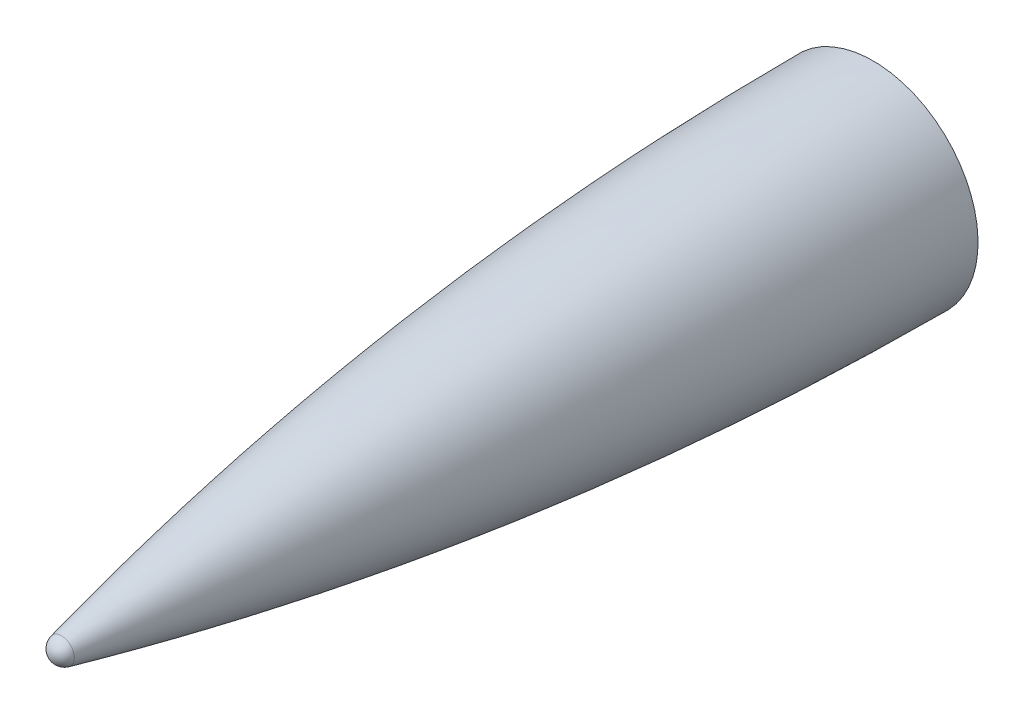
from build123d import *


with BuildPart() as part:
    # Sketch2 → Revolve3 (revolve)
    with BuildSketch(Plane(origin=(0, 0, 0), x_dir=(0, 0, -1), z_dir=(1, 0, 0))):
        with BuildLine():
            Line((0, 0), (0, 50.8))
            add(Edge.make_bspline(
                [(-393.094962658, 6.188510445), (-392.615474646, 6.298762531), (-391.662141732, 6.517426214), (-388.821951047, 7.167233862), (-385.764371439, 7.858883348), (-381.511309012, 8.814017229), (-375.878946011, 10.06024323), (-370.030644638, 11.334405211), (-364.308819986, 12.557770181), (-357.356154027, 14.019635599), (-350.438590771, 15.447374252), (-343.487091036, 16.850349791), (-336.547927411, 18.217927146), (-330.752076671, 19.338908465), (-326.117332404, 20.222226526), (-317.998879836, 21.747006462), (-306.391088709, 23.862468279), (-293.603006318, 26.086587187), (-279.631928109, 28.387522391), (-265.644479942, 30.588214451), (-251.641677432, 32.688469007), (-237.620375858, 34.663096369), (-223.582115236, 36.511862914), (-209.531002505, 38.259857886), (-193.123747311, 40.181523174), (-176.69642632, 41.926538459), (-160.251447319, 43.494641811), (-146.144483907, 44.712240173), (-134.383399306, 45.663631778), (-122.615699153, 46.530620749), (-110.842109395, 47.313156137), (-96.707471975, 48.150801022), (-84.923897035, 48.764313665), (-73.136088936, 49.293264675), (-62.524190954, 49.693188726), (-55.448191673, 49.928076693), (-49.551411497, 50.102661885), (-44.83263635, 50.229636147), (-38.936054307, 50.37248547), (-33.03489047, 50.494175399), (-27.140479685, 50.594704101), (-21.824811931, 50.666133586), (-18.29560142, 50.705816978), (-15.327055488, 50.733595513), (-13.004964767, 50.752643727), (-10.572726913, 50.76851729), (-8.340644298, 50.781216176), (-5.759760209, 50.79074036), (-3.787780928, 50.797089826), (-1.491466793, 50.799470877), (-0.492000182, 50.8), (0, 50.8)],
                knots=[0.083370066, 0.083370066, 0.083370066, 0.083370066, 0.083370066, 0.08833398, 0.093297894, 0.103225722, 0.113153551, 0.123081379, 0.142937033, 0.152864859, 0.162792686, 0.182648336, 0.202503986, 0.212431813, 0.222359641, 0.232287468, 0.242215295, 0.2819266, 0.321637903, 0.341493557, 0.36134921, 0.401060515, 0.440771818, 0.460627472, 0.480483126, 0.520194431, 0.579761387, 0.599617041, 0.619472694, 0.639328346, 0.679039651, 0.698895304, 0.718750957, 0.758462262, 0.778317914, 0.798173566, 0.808101393, 0.81802922, 0.827957046, 0.837884873, 0.857740525, 0.867668352, 0.877596178, 0.882560091, 0.887524004, 0.892487917, 0.89745183, 0.902415744, 0.907379657, 0.91234357, 0.917307483, 0.917307483, 0.917307483, 0.917307483, 0.917307483], degree=4))
            ThreePointArc((-393.094962658, 6.188510445), (-396.639808273, 3.955164471), (-398.021994467, 0))
            Line((-398.021994467, 0), (0, 0))
        make_face()
    revolve(axis=Axis((0, 0, 398.021994467), (0, 0, -1)))


solid = part.part
